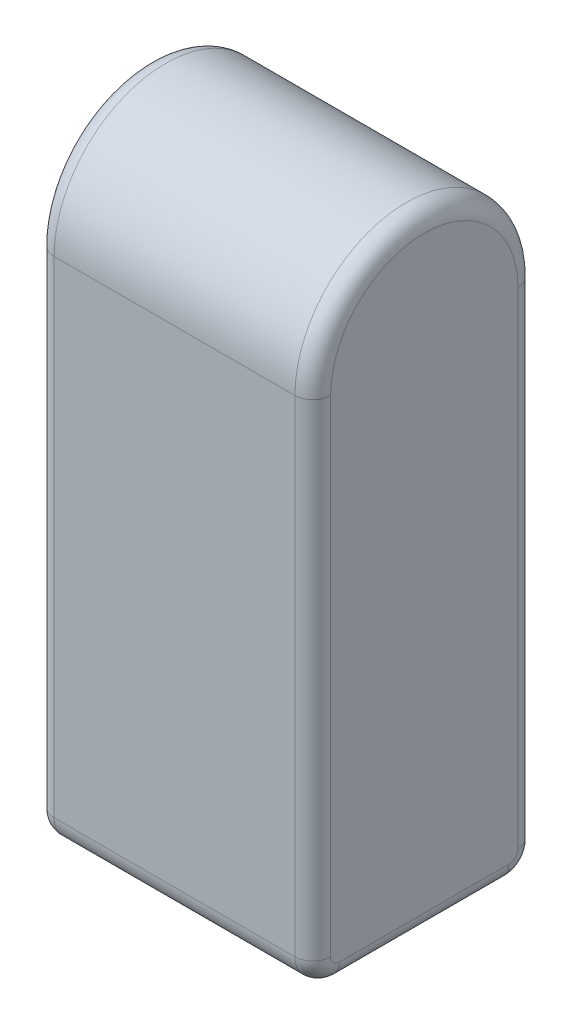
from build123d import *

# Parameters (mm, degrees)
BOSS_EXTRUDE1_DEPTH = 15.5
FILLET1_R           = 3
FILLET2_R           = 2


with BuildPart() as part:
    # Sketch1 → Boss-Extrude1 (new, symmetric)
    with BuildSketch(Plane(origin=(0, 0, 0), x_dir=(0, 0, -1), z_dir=(1, 0, 0))):
        with BuildLine():
            Line((-12.5, 57.5), (-12.5, 0))
            Line((-12.5, 0), (12.5, 0))
            Line((12.5, 0), (12.5, 57.5))
            ThreePointArc((12.5, 57.5), (0, 70), (-12.5, 57.5))
        make_face()
    extrude(amount=BOSS_EXTRUDE1_DEPTH, both=True)

    # Fillet1
    fillet1_edges = [part.edges().sort_by_distance(p)[0] for p in [
        (0, 0, -12.5),
        (0, 0, 12.5),
    ]]
    fillet(fillet1_edges, radius=FILLET1_R)

    # Fillet2
    fillet2_edges = [part.edges().sort_by_distance(p)[0] for p in [
        (-15.5, 30.25, -12.5),
        (15.5, 30.25, -12.5),
        (-15.5, 0, 0),
        (-15.5, 0.878679656, 11.621320344),
        (-15.5, 0.878679656, -11.621320344),
        (15.5, 0, 0),
        (15.5, 0.878679656, 11.621320344),
        (15.5, 0.878679656, -11.621320344),
        (15.5, 70, 0),
        (-15.5, 30.25, 12.5),
        (-15.5, 70, 0),
        (15.5, 30.25, 12.5),
    ]]
    fillet(fillet2_edges, radius=FILLET2_R)


solid = part.part
